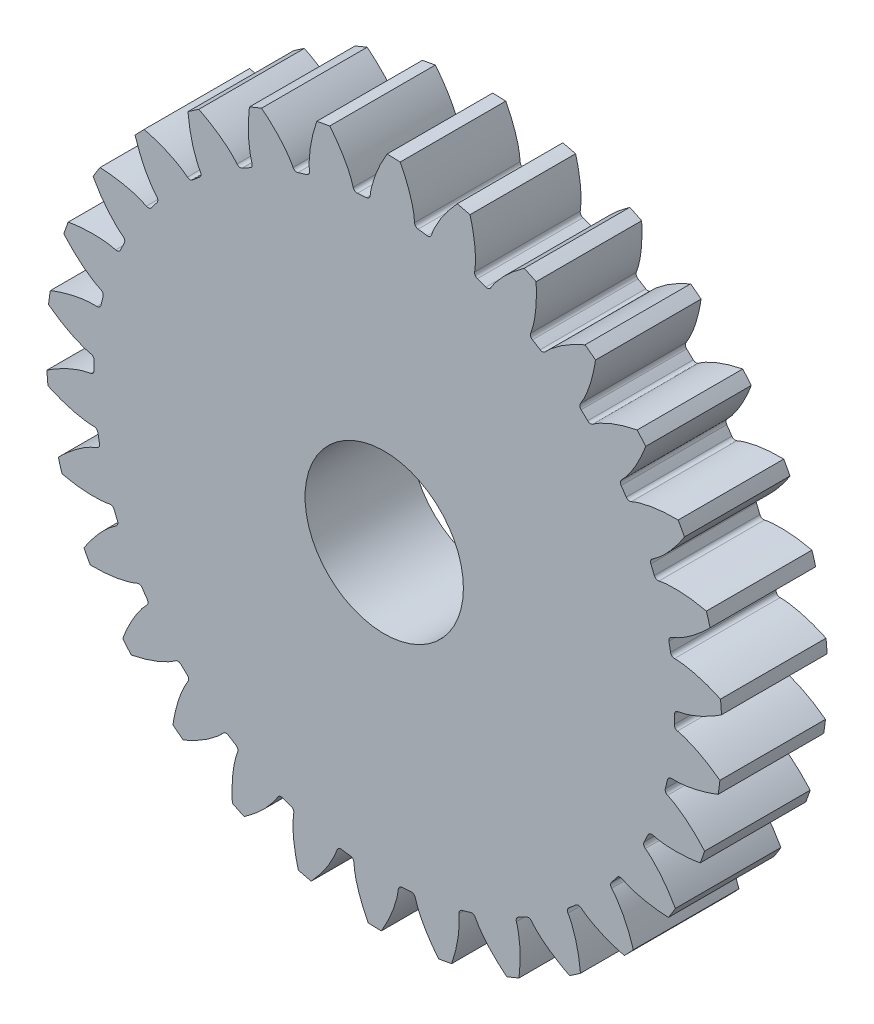
from build123d import *

# Parameters (mm, degrees)
SKETCH_4_R               = 27.5
SKETCH_4_R_2             = 7.5
EXTRUDE_1_DEPTH          = 5
EXTRUDE_2_DEPTH          = 5
PATTERN_CIRCULAR_1_COUNT = 30


with BuildPart() as part:
    # 草图4 → 凸台-拉伸1 (new, symmetric)
    with BuildSketch(Plane.XY):
        Circle(SKETCH_4_R)
        Circle(SKETCH_4_R_2, mode=Mode.SUBTRACT)
    extrude_1 = extrude(amount=EXTRUDE_1_DEPTH, both=True)

    # 草图2 → 凸台-拉伸2 (add, symmetric)
    with BuildSketch(Plane.XY):
        with BuildLine():
            ThreePointArc((27.497916089, -0.338542093), (27.418794145, 2.111806722), (27.121755072, 4.54537147))
            ThreePointArc((27.121755072, 4.54537147), (27.251400903, 4.317814086), (27.497482988, 4.228181438))
            add(Edge.make_bspline(
                [(27.497482988, 4.228181438), (27.518138428, 4.228232686), (27.564869771, 4.227957748), (27.670613415, 4.226225772), (27.780028942, 4.220912688), (27.922826653, 4.212099781), (28.058350997, 4.199852061), (28.200907358, 4.184831282), (28.338903888, 4.167243266), (28.479115696, 4.147206979), (28.61741002, 4.124959973), (28.756383652, 4.100444791), (28.919500866, 4.069197995), (29.11748528, 4.027465369), (29.347178119, 3.974244353), (29.61212085, 3.905533934), (29.880502551, 3.829765234), (30.152993761, 3.745186922), (30.414197022, 3.659200808), (30.688882884, 3.560636788), (30.936447684, 3.468510889), (31.223603985, 3.352182284), (31.440033764, 3.262882768), (31.686388928, 3.152897069), (31.795450432, 3.103317942), (31.851691273, 3.077298014)],
                knots=[0.03089713, 0.03089713, 0.03089713, 0.03089713, 0.03089713, 0.04911433, 0.072034625, 0.09936099, 0.126687604, 0.154014377, 0.181340804, 0.208667316, 0.235994017, 0.263320543, 0.290646985, 0.317973654, 0.365368606, 0.420021682, 0.474674824, 0.529327958, 0.583981045, 0.638634082, 0.69328723, 0.747940322, 0.802593459, 0.857246576, 0.91190039, 0.91190039, 0.91190039, 0.91190039, 0.91190039], degree=4))
            ThreePointArc((31.851691273, 3.077298014), (31.905505914, 2.457375094), (31.947256273, 1.836522979))
            add(Edge.make_bspline(
                [(27.820637521, 0.03244257), (27.841057192, 0.035554939), (27.887195271, 0.042982704), (27.991426524, 0.060887002), (28.09873797, 0.082892455), (28.238501946, 0.113468338), (28.370552358, 0.146324737), (28.509127206, 0.182998317), (28.642802876, 0.221510597), (28.778292788, 0.262781504), (28.911549299, 0.305943428), (29.045129775, 0.351450799), (29.201538251, 0.407307548), (29.390796976, 0.478865743), (29.609630907, 0.56663241), (29.860927056, 0.675103684), (30.114540767, 0.79107661), (30.370866482, 0.916384542), (30.615821803, 1.041355124), (30.872174625, 1.180819885), (31.102712141, 1.30976935), (31.368667994, 1.468698801), (31.568870515, 1.590087446), (31.795477753, 1.736500836), (31.895660798, 1.802196033), (31.947256273, 1.836522979)],
                knots=[0.03089713, 0.03089713, 0.03089713, 0.03089713, 0.03089713, 0.04911433, 0.072034625, 0.09936099, 0.126687604, 0.154014377, 0.181340804, 0.208667316, 0.235994017, 0.263320543, 0.290646985, 0.317973654, 0.365368606, 0.420021682, 0.474674824, 0.529327958, 0.583981045, 0.638634082, 0.69328723, 0.747940322, 0.802593459, 0.857246576, 0.91190039, 0.91190039, 0.91190039, 0.91190039, 0.91190039], degree=4))
            ThreePointArc((27.820637521, 0.03244257), (27.591185444, -0.093816742), (27.497916089, -0.338542093))
        make_face()
    extrude_2 = extrude(amount=EXTRUDE_2_DEPTH, both=True)

    # 阵列(圆周)1: 凸台-拉伸1, 凸台-拉伸2 ×30 about axis
    pattern_circular_1_axis = Axis((0, 0, 5), (0, 0, -1))
    add([extrude_1.rotate(pattern_circular_1_axis, i * 360 / PATTERN_CIRCULAR_1_COUNT) for i in range(1, PATTERN_CIRCULAR_1_COUNT)])
    add([extrude_2.rotate(pattern_circular_1_axis, i * 360 / PATTERN_CIRCULAR_1_COUNT) for i in range(1, PATTERN_CIRCULAR_1_COUNT)])


solid = part.part
